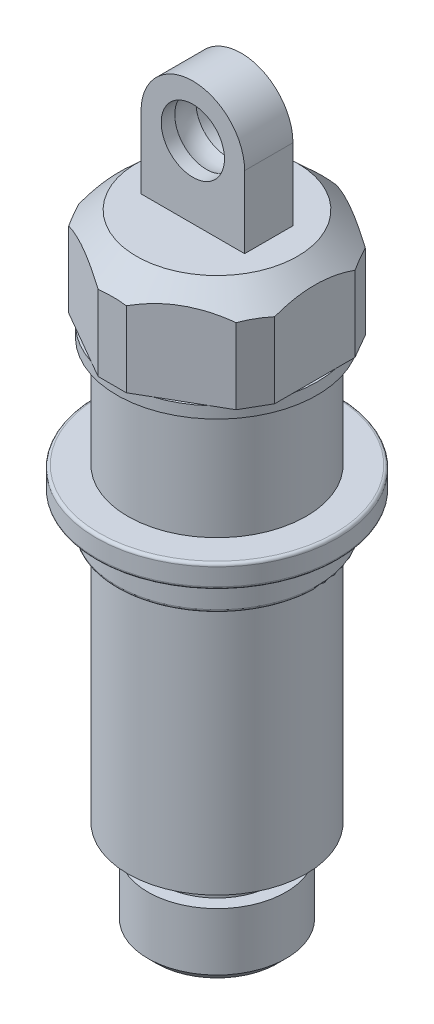
from build123d import *

# Parameters (mm, degrees)
BOSS_EXTRUDE1_DEPTH  = 8.6
CHAMFER1_SIZE        = 1.414
CHAMFER1_EDGE_2_SIZE = 1.414
CHAMFER1_EDGE_3_SIZE = 1.414
CHAMFER1_EDGE_4_SIZE = 1.414
CHAMFER1_EDGE_5_SIZE = 1.414
CHAMFER1_EDGE_6_SIZE = 1.414
FILLET1_R            = 0.25
SKETCH6_R            = 1.5
CUT_EXTRUDE1_DEPTH   = 28
BOSS_EXTRUDE2_DEPTH  = 2.1
SKETCH9_R            = 2.75
CUT_EXTRUDE2_DEPTH   = 4.2
CHAMFER3_SIZE        = 0.75


with BuildPart() as part:
    # Sketch1 → Revolve1 (revolve)
    with BuildSketch(Plane.XY, mode=Mode.PRIVATE) as revolve1_sk:
        Polygon((0, 0), (6, 0), (6, 5.75), (4.875, 5.75), (4.875, 6.5), (7.75, 8), (7.75, 44.5), (8.7, 44.5), (8.7, 45.5), (0, 45.5), align=None)
    revolve(revolve1_sk.sketch.rotate(Axis((0, 45.5, 0), (0, -1, 0)), 180), axis=Axis((0, 45.5, 0), (0, -1, 0)))

    # Sketch3 → Boss-Extrude1 (add)
    with BuildSketch(Plane(origin=(0, 45.5, 0), x_dir=(1, 0, 0), z_dir=(0, 1, 0))):
        Polygon((0, 9.814954576), (-8.5, 4.907477288), (-8.5, -4.907477288), (0, -9.814954576), (8.5, -4.907477288), (8.5, 4.907477288), align=None)
    extrude(amount=BOSS_EXTRUDE1_DEPTH)

    # Chamfer1
    chamfer1_edges = [part.edges().sort_by_distance(p)[0] for p in [
        (8.5, 49.8, -4.907477288),
    ]]
    chamfer(chamfer1_edges, length=CHAMFER1_SIZE)

    # Chamfer1 edge 2
    chamfer1_edge_2_edges = [part.edges().sort_by_distance(p)[0] for p in [
        (0, 49.8, -9.814954576),
    ]]
    chamfer(chamfer1_edge_2_edges, length=CHAMFER1_EDGE_2_SIZE)

    # Chamfer1 edge 3
    chamfer1_edge_3_edges = [part.edges().sort_by_distance(p)[0] for p in [
        (-8.5, 49.8, -4.907477288),
    ]]
    chamfer(chamfer1_edge_3_edges, length=CHAMFER1_EDGE_3_SIZE)

    # Chamfer1 edge 4
    chamfer1_edge_4_edges = [part.edges().sort_by_distance(p)[0] for p in [
        (-8.5, 49.8, 4.907477288),
    ]]
    chamfer(chamfer1_edge_4_edges, length=CHAMFER1_EDGE_4_SIZE)

    # Chamfer1 edge 5
    chamfer1_edge_5_edges = [part.edges().sort_by_distance(p)[0] for p in [
        (0, 49.8, 9.814954576),
    ]]
    chamfer(chamfer1_edge_5_edges, length=CHAMFER1_EDGE_5_SIZE)

    # Chamfer1 edge 6
    chamfer1_edge_6_edges = [part.edges().sort_by_distance(p)[0] for p in [
        (8.5, 49.8, 4.907477288),
    ]]
    chamfer(chamfer1_edge_6_edges, length=CHAMFER1_EDGE_6_SIZE)

    # Sketch5 → Revolve2 (revolve)
    with BuildSketch(Plane.XY, mode=Mode.PRIVATE) as revolve2_sk:
        Polygon((7.75, 34.901965379), (10.5, 34.901965379), (10.5, 32.901965379), (8.7, 32.901965379), (8.7, 29.901965379), (7.75, 29.901965379), align=None)
    revolve(revolve2_sk.sketch.rotate(Axis((0, 0, 0), (0, 1, 0)), 180), axis=Axis((0, 0, 0), (0, 1, 0)))

    # Fillet1
    fillet1_edges = [part.edges().sort_by_distance(p)[0] for p in [
        (10.5, 34.901965379, 0),
        (10.5, 32.901965379, 0),
        (8.7, 29.901965379, 0),
    ]]
    fillet(fillet1_edges, radius=FILLET1_R)

    # Sketch6 → Cut-Extrude1 (cut)
    with BuildSketch(Plane.XZ):
        Circle(SKETCH6_R)
    extrude(amount=-CUT_EXTRUDE1_DEPTH, mode=Mode.SUBTRACT)

    # Sketch7 → Boss-Extrude2 (add, symmetric)
    with BuildSketch(Plane.XY):
        with BuildLine():
            Line((4.5, 60.35), (4.5, 54.1))
            Line((4.5, 54.1), (-4.5, 54.1))
            Line((-4.5, 54.1), (-4.5, 60.35))
            ThreePointArc((-4.5, 60.35), (0, 64.85), (4.5, 60.35))
        make_face()
    extrude(amount=BOSS_EXTRUDE2_DEPTH, both=True)

    # Sketch8 → Cut-Revolve1 (revolve, cut)
    with BuildSketch(Plane.XY):
        with BuildLine():
            Line((0, 63.25), (0, 57.45))
            ThreePointArc((0, 57.45), (2.9, 60.35), (0, 63.25))
        make_face()
    revolve(axis=Axis((0, 54.1, 0), (0, 1, 0)), mode=Mode.SUBTRACT)

    # Sketch9 → Cut-Extrude2 (cut)
    with BuildSketch(Plane.XY.offset(2.1)):
        with Locations((0, 60.35)):
            Circle(SKETCH9_R)
    extrude(amount=-CUT_EXTRUDE2_DEPTH, mode=Mode.SUBTRACT)

    # Sketch10 → Cut-Revolve2 (revolve, cut)
    with BuildSketch(Plane.XY, mode=Mode.PRIVATE) as cut_revolve2_sk:
        Polygon((7, 54.1), (8.5, 52.7), (10.124681139, 51.183630937), (10.124681139, 53.919402207), (7, 56.83577127), align=None)
    revolve(cut_revolve2_sk.sketch.rotate(Axis((0, 0, 0), (0, 1, 0)), 90), axis=Axis((0, 0, 0), (0, 1, 0)), mode=Mode.SUBTRACT)

    # Chamfer3
    chamfer3_edges = [part.edges().sort_by_distance(p)[0] for p in [
        (6, 0, 0),
    ]]
    chamfer(chamfer3_edges, length=CHAMFER3_SIZE)


solid = part.part
